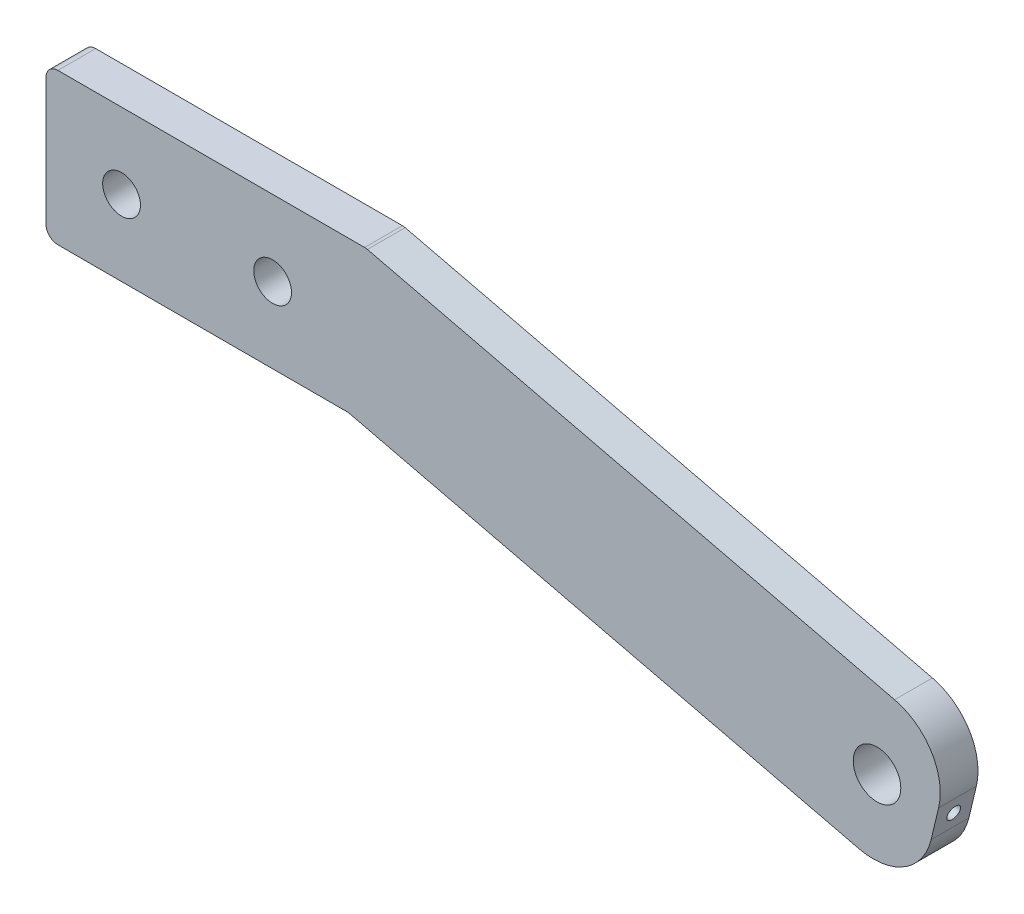
from build123d import *

# Parameters (mm, degrees)
SKETCH1_R               = 3.175
SKETCH1_R_2             = 4
BOSS_EXTRUDE1_DEPTH     = 6.35
CUT_EXTRUDE2_REACH      = 155.866
CUT_EXTRUDE2_END_RADIUS = 4
SKETCH3_R               = 1.1303
FILLET4_R               = 10
SKETCH4_W               = 6.35
SKETCH4_H               = 6.35
SKETCH4_W_2             = 19.05
BOSS_EXTRUDE2_DEPTH     = 4.7625
FILLET3_R               = 2


with BuildPart() as part:
    # Sketch1 → Boss-Extrude1 (new body)
    with BuildSketch(Plane.XY):
        Polygon((-38.1, -12.7), (-38.1, 12.7), (15.701735639, 12.7), (114.28491418, -10.930870684), (108.364133554, -35.631161305), (12.7, -12.7), align=None)
        with Locations((-25.4, 0)):
            Circle(SKETCH1_R, mode=Mode.SUBTRACT)
        Circle(SKETCH1_R, mode=Mode.SUBTRACT)
        with Locations((101.6, -20.95)):
            Circle(SKETCH1_R_2, mode=Mode.SUBTRACT)
    extrude(amount=BOSS_EXTRUDE1_DEPTH)

    # Cut-Extrude2: up to this cylinder (the profile starts outside it)
    cut_extrude2_end = Plane(origin=(101.6, -20.95, 3.175), z_dir=(0, 0, -1)) * Cylinder(CUT_EXTRUDE2_END_RADIUS, 320.732, mode=Mode.PRIVATE)
    # Sketch3 → Cut-Extrude2 (cut, up to the surface)
    with BuildSketch(Plane(origin=(110.552900462, -26.500071647, 0), x_dir=(0, 0, -1), z_dir=(0.9724523866696595, -0.23310159943784806, 0)), mode=Mode.PRIVATE) as cut_extrude2_sk1:
        with Locations(Location((-3.175, 3.310245002, 0), (0, 0, 90))):
            Circle(SKETCH3_R)
    cut_extrude2_tool1 = extrude(cut_extrude2_sk1.sketch, amount=-CUT_EXTRUDE2_REACH, mode=Mode.PRIVATE) - cut_extrude2_end
    add(cut_extrude2_tool1.solids().sort_by_distance((111.324524, -23.281016, 3.175))[0], mode=Mode.SUBTRACT)

    # Fillet4
    fillet4_edges = [part.edges().sort_by_distance(p)[0] for p in [
        (108.364133554, -35.631161305, 3.175),
        (114.28491418, -10.930870684, 3.175),
    ]]
    fillet(fillet4_edges, radius=FILLET4_R)

    # Sketch4 → Boss-Extrude2 (add)
    with BuildSketch(Plane.XY):
        with Locations((-12.7, 0)):
            Rectangle(SKETCH4_W, SKETCH4_H)
        with Locations((19.05, 0)):
            Rectangle(SKETCH4_W_2, SKETCH4_H)
    extrude(amount=-BOSS_EXTRUDE2_DEPTH)

    # Fillet3
    fillet3_edges = [part.edges().sort_by_distance(p)[0] for p in [
        (12.7, -12.7, 3.175),
        (-38.1, -12.7, 3.175),
        (-38.1, 12.7, 3.175),
        (15.701735639, 12.7, 3.175),
        (-9.525, -3.175, -2.38125),
        (-15.875, -3.175, -2.38125),
        (-15.875, 3.175, -2.38125),
        (-9.525, 3.175, -2.38125),
        (28.575, -3.175, -2.38125),
        (9.525, -3.175, -2.38125),
        (9.525, 3.175, -2.38125),
        (28.575, 3.175, -2.38125),
    ]]
    fillet(fillet3_edges, radius=FILLET3_R)


solid = part.part
